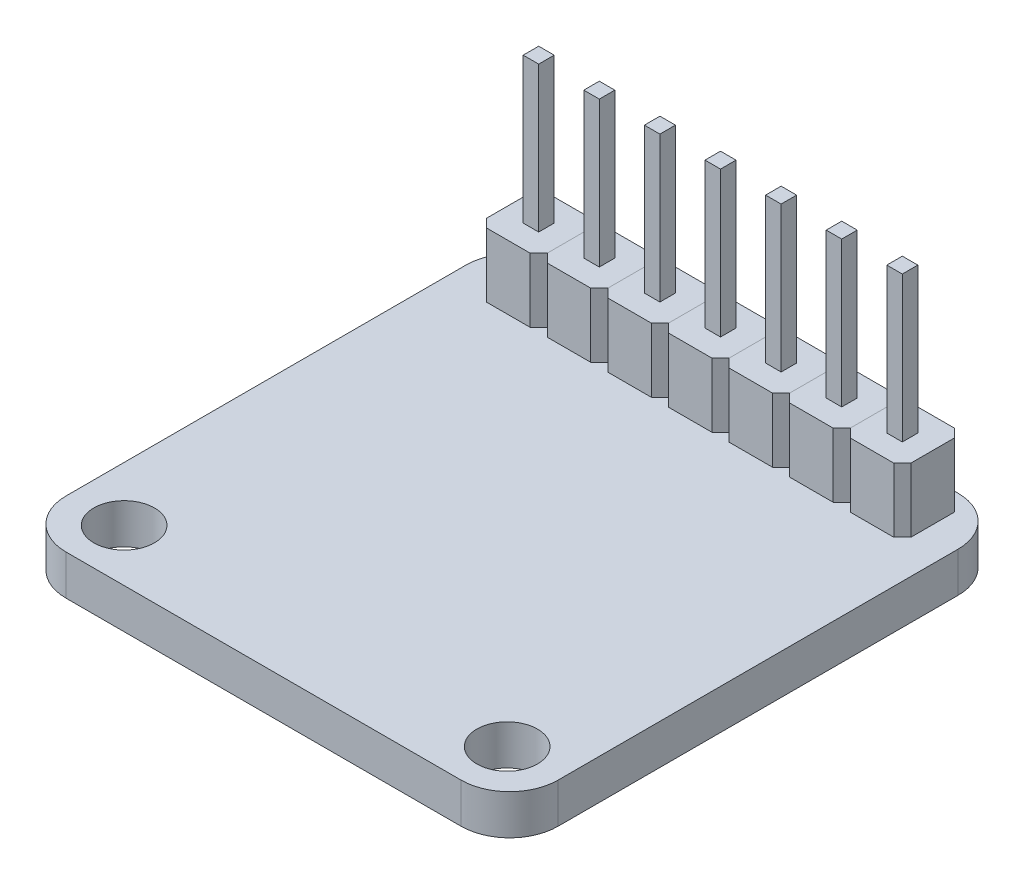
from build123d import *

# Parameters (mm, degrees)
SKETCH1_W           = 20.3
SKETCH1_H           = 20.5
BOSS_EXTRUDE1_DEPTH = 1.65
FILLET1_R           = 2
SKETCH2_R           = 1.25
CUT_EXTRUDE1_DEPTH  = 15.519211411
BOSS_EXTRUDE2_DEPTH = 2.65
SKETCH4_W           = 0.64
SKETCH4_H           = 0.64
BOSS_EXTRUDE3_DEPTH = 6
LPATTERN1_COUNT     = 7
LPATTERN1_PITCH     = 2.5
SKETCH5_W           = 17.5
SKETCH5_H           = 11
BOSS_EXTRUDE4_DEPTH = 1.35


with BuildPart() as part:
    # Sketch1 → Boss-Extrude1 (new body)
    with BuildSketch(Plane(origin=(0, 0, 0), x_dir=(1, 0, 0), z_dir=(0, 1, 0))):
        Rectangle(SKETCH1_W, SKETCH1_H)
    extrude(amount=BOSS_EXTRUDE1_DEPTH)

    # Fillet1
    fillet1_edges = [part.edges().sort_by_distance(p)[0] for p in [
        (10.15, 0.825, 10.25),
        (-10.15, 0.825, 10.25),
        (-10.15, 0.825, -10.25),
        (10.15, 0.825, -10.25),
    ]]
    fillet(fillet1_edges, radius=FILLET1_R)

    # Sketch2 → Cut-Extrude1 (cut, through all)
    with BuildSketch(Plane(origin=(0, 1.65, 0), x_dir=(1, 0, 0), z_dir=(0, 1, 0))):
        with Locations(Location((7.9, -8.1, 0), (0, 0, 270))):
            Circle(SKETCH2_R)
        with Locations(Location((-7.9, -8.1, 0), (0, 0, 270))):
            Circle(SKETCH2_R)
    extrude(amount=-CUT_EXTRUDE1_DEPTH, mode=Mode.SUBTRACT)

    # Sketch3 → Boss-Extrude2 (add)
    with BuildSketch(Plane(origin=(0, 1.65, 0), x_dir=(1, 0, 0), z_dir=(0, 1, 0))):
        Polygon((-8.395, 9.85), (-6.602128422, 9.85), (-6.248596673, 9.496424969), (-6.248596673, 7.703553391), (-6.602150064, 7.35), (-8.395021642, 7.35), (-8.748553391, 7.703575031), (-8.748553391, 9.496446609), align=None)
    boss_extrude2 = extrude(amount=BOSS_EXTRUDE2_DEPTH)

    # Sketch4 → Boss-Extrude3 (add)
    with BuildSketch(Plane(origin=(0, 4.3, 0), x_dir=(1, 0, 0), z_dir=(0, 1, 0))):
        with Locations((-7.498564211, 8.60001082)):
            Rectangle(SKETCH4_W, SKETCH4_H)
    boss_extrude3 = extrude(amount=BOSS_EXTRUDE3_DEPTH)

    # LPattern1: Boss-Extrude2, Boss-Extrude3 ×7
    with Locations(*[(i * LPATTERN1_PITCH, 0, 0) for i in range(1, LPATTERN1_COUNT)]):
        add(boss_extrude2)
        add(boss_extrude3)

    # Sketch5 → Boss-Extrude4 (add)
    with BuildSketch(Plane.XZ):
        with Locations((0, -1)):
            Rectangle(SKETCH5_W, SKETCH5_H)
    extrude(amount=BOSS_EXTRUDE4_DEPTH)


solid = part.part
